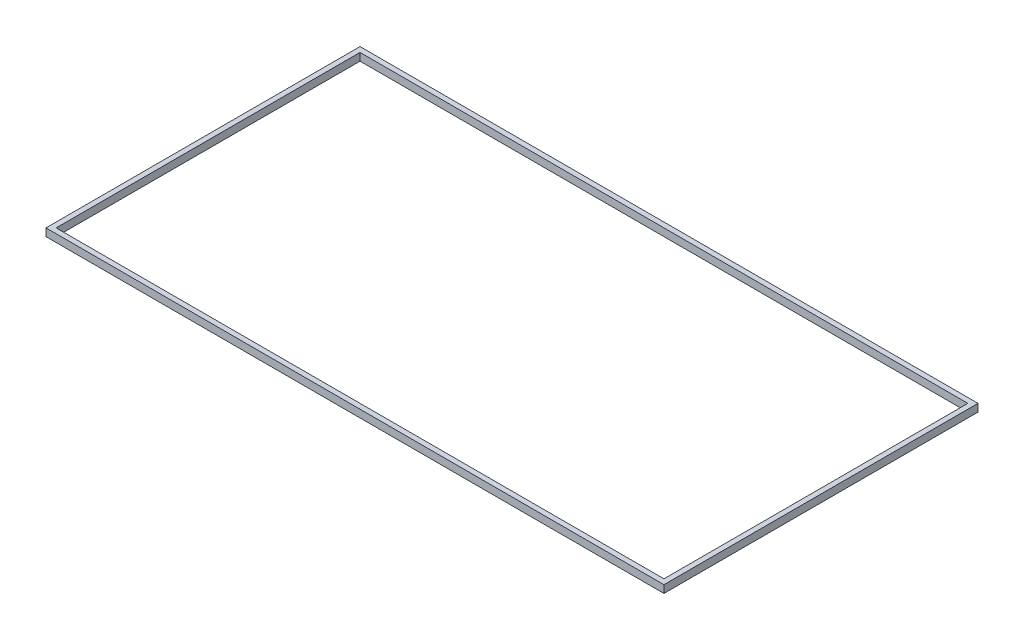
from build123d import *

# Parameters (mm, degrees)
SKETCH1_W           = 2440
SKETCH1_H           = 1240
SKETCH1_W_2         = 2400
SKETCH1_H_2         = 1200
BOSS_EXTRUDE1_DEPTH = 15


with BuildPart() as part:
    # Sketch1 → Boss-Extrude1 (new, symmetric)
    with BuildSketch(Plane(origin=(0, 0, 0), x_dir=(1, 0, 0), z_dir=(0, 1, 0))):
        Rectangle(SKETCH1_W, SKETCH1_H)
        Rectangle(SKETCH1_W_2, SKETCH1_H_2, mode=Mode.SUBTRACT)
    extrude(amount=BOSS_EXTRUDE1_DEPTH, both=True)


solid = part.part
